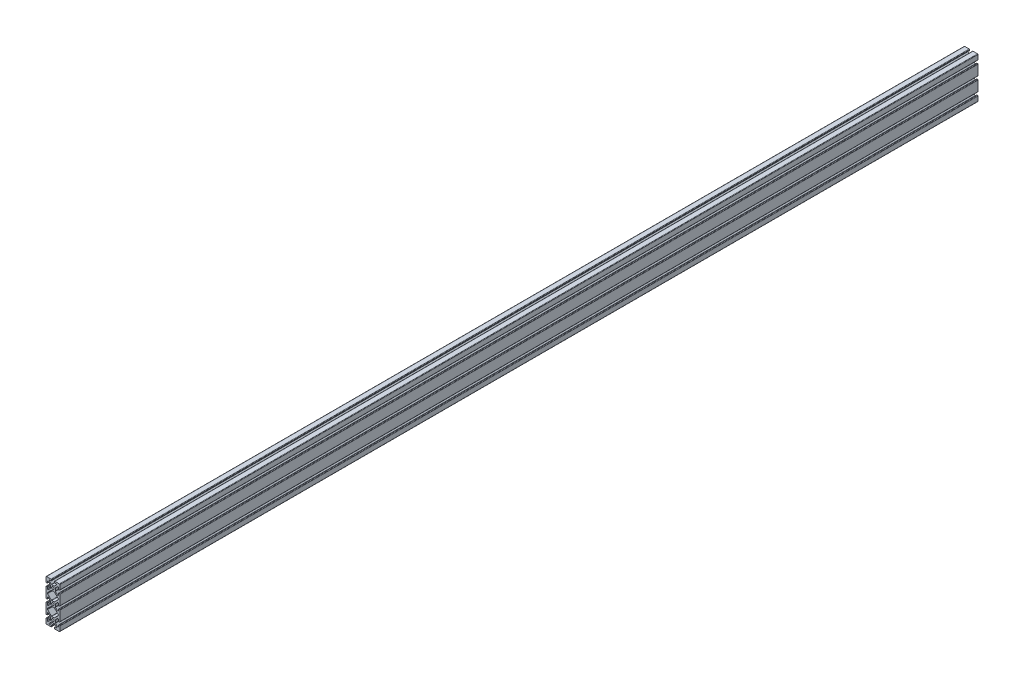
from build123d import *

# Parameters (mm, degrees)
SKETCH1_R           = 3.3274
BOSS_EXTRUDE1_DEPTH = 2540
FILLET1_R           = 1.27


with BuildPart() as part:
    # Sketch1 → Boss-Extrude1 (new body)
    with BuildSketch(Plane.XY):
        Polygon((-12.112318041, 14.986), (-3.882718041, 6.7564), (3.882718041, 6.7564), (12.112318041, 14.986), (4.064, 14.986), (4.064, 19.05), (19.05, 19.05), (19.05, 4.064), (14.986, 4.064), (14.986, 12.112318041), (6.7564, 3.882718041), (6.7564, -3.882718041), (14.986, -12.112318041), (14.986, -4.064), (19.05, -4.064), (19.05, -34.036), (14.986, -34.036), (14.986, -25.987681959), (6.7564, -34.217281959), (6.7564, -41.982718041), (14.986, -50.212318041), (14.986, -42.164), (19.05, -42.164), (19.05, -72.136), (14.986, -72.136), (14.986, -64.087681959), (6.7564, -72.317281959), (6.7564, -80.082718041), (14.986, -88.312318041), (14.986, -80.264), (19.05, -80.264), (19.05, -95.25), (4.064, -95.25), (4.064, -91.186), (12.112318041, -91.186), (3.882718041, -82.9564), (-3.882718041, -82.9564), (-12.112318041, -91.186), (-4.064, -91.186), (-4.064, -95.25), (-19.05, -95.25), (-19.05, -80.264), (-14.986, -80.264), (-14.986, -88.312318041), (-6.7564, -80.082718041), (-6.7564, -72.317281959), (-14.986, -64.087681959), (-14.986, -72.136), (-19.05, -72.136), (-19.05, -42.164), (-14.986, -42.164), (-14.986, -50.212318041), (-6.7564, -41.982718041), (-6.7564, -34.217281959), (-14.986, -25.987681959), (-14.986, -34.036), (-19.05, -34.036), (-19.05, -4.064), (-14.986, -4.064), (-14.986, -12.112318041), (-6.7564, -3.882718041), (-6.7564, 3.882718041), (-14.986, 12.112318041), (-14.986, 4.064), (-19.05, 4.064), (-19.05, 19.05), (-4.064, 19.05), (-4.064, 14.986), align=None)
        with Locations(Location((0, 0, 0), (0, 0, 180))):
            Circle(SKETCH1_R, mode=Mode.SUBTRACT)
        with Locations(Location((0, -38.1, 0), (0, 0, 180))):
            Circle(SKETCH1_R, mode=Mode.SUBTRACT)
        with Locations(Location((0, -76.2, 0), (0, 0, 180))):
            Circle(SKETCH1_R, mode=Mode.SUBTRACT)
        Polygon((-3.882718041, -6.7564), (-14.986, -17.859681959), (-14.986, -20.240318041), (-3.882718041, -31.3436), (3.882718041, -31.3436), (14.986, -20.240318041), (14.986, -17.859681959), (3.882718041, -6.7564), align=None, mode=Mode.SUBTRACT)
        Polygon((14.986, -58.340318041), (14.986, -55.959681959), (3.882718041, -44.8564), (-3.882718041, -44.8564), (-14.986, -55.959681959), (-14.986, -58.340318041), (-3.882718041, -69.4436), (3.882718041, -69.4436), align=None, mode=Mode.SUBTRACT)
    extrude(amount=BOSS_EXTRUDE1_DEPTH)

    # Fillet1
    fillet1_edges = [part.edges().sort_by_distance(p)[0] for p in [
        (-19.05, 19.05, 1270),
        (-4.064, 19.05, 1270),
        (-4.064, 14.986, 1270),
        (-12.112318041, 14.986, 1270),
        (-3.882718041, 6.7564, 1270),
        (3.882718041, 6.7564, 1270),
        (12.112318041, 14.986, 1270),
        (4.064, 14.986, 1270),
        (4.064, 19.05, 1270),
        (19.05, 19.05, 1270),
        (19.05, 4.064, 1270),
        (14.986, 4.064, 1270),
        (14.986, 12.112318041, 1270),
        (6.7564, 3.882718041, 1270),
        (6.7564, -3.882718041, 1270),
        (14.986, -12.112318041, 1270),
        (14.986, -4.064, 1270),
        (19.05, -4.064, 1270),
        (19.05, -34.036, 1270),
        (14.986, -34.036, 1270),
        (14.986, -25.987681959, 1270),
        (6.7564, -34.217281959, 1270),
        (6.7564, -41.982718041, 1270),
        (14.986, -50.212318041, 1270),
        (14.986, -42.164, 1270),
        (19.05, -42.164, 1270),
        (19.05, -72.136, 1270),
        (14.986, -72.136, 1270),
        (14.986, -64.087681959, 1270),
        (6.7564, -72.317281959, 1270),
        (6.7564, -80.082718041, 1270),
        (14.986, -88.312318041, 1270),
        (14.986, -80.264, 1270),
        (19.05, -80.264, 1270),
        (19.05, -95.25, 1270),
        (4.064, -95.25, 1270),
        (4.064, -91.186, 1270),
        (12.112318041, -91.186, 1270),
        (3.882718041, -82.9564, 1270),
        (-3.882718041, -82.9564, 1270),
        (-12.112318041, -91.186, 1270),
        (-4.064, -91.186, 1270),
        (-4.064, -95.25, 1270),
        (-19.05, -95.25, 1270),
        (-19.05, -80.264, 1270),
        (-14.986, -80.264, 1270),
        (-14.986, -88.312318041, 1270),
        (-6.7564, -80.082718041, 1270),
        (-6.7564, -72.317281959, 1270),
        (-14.986, -64.087681959, 1270),
        (-14.986, -72.136, 1270),
        (-19.05, -72.136, 1270),
        (-19.05, -42.164, 1270),
        (-14.986, -42.164, 1270),
        (-14.986, -50.212318041, 1270),
        (-6.7564, -41.982718041, 1270),
        (-6.7564, -34.217281959, 1270),
        (-14.986, -25.987681959, 1270),
        (-14.986, -34.036, 1270),
        (-19.05, -34.036, 1270),
        (-19.05, -4.064, 1270),
        (-14.986, -4.064, 1270),
        (-14.986, -12.112318041, 1270),
        (-6.7564, -3.882718041, 1270),
        (-6.7564, 3.882718041, 1270),
        (-14.986, 12.112318041, 1270),
        (-14.986, 4.064, 1270),
        (-19.05, 4.064, 1270),
        (14.986, -20.240318041, 1270),
        (14.986, -17.859681959, 1270),
        (3.882718041, -6.7564, 1270),
        (-3.882718041, -6.7564, 1270),
        (-14.986, -17.859681959, 1270),
        (-14.986, -20.240318041, 1270),
        (-3.882718041, -31.3436, 1270),
        (3.882718041, -31.3436, 1270),
        (3.882718041, -69.4436, 1270),
        (14.986, -58.340318041, 1270),
        (14.986, -55.959681959, 1270),
        (3.882718041, -44.8564, 1270),
        (-3.882718041, -44.8564, 1270),
        (-14.986, -55.959681959, 1270),
        (-14.986, -58.340318041, 1270),
        (-3.882718041, -69.4436, 1270),
    ]]
    fillet(fillet1_edges, radius=FILLET1_R)


solid = part.part
